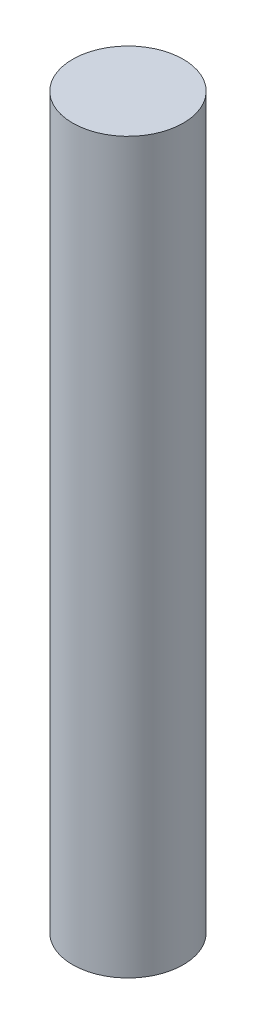
from build123d import *

# Parameters (mm, degrees)
SKETCH1_R           = 10.795
BOSS_EXTRUDE1_DEPTH = 142.24


with BuildPart() as part:
    # Sketch1 → Boss-Extrude1 (new body)
    with BuildSketch(Plane(origin=(0, 0, 0), x_dir=(1, 0, 0), z_dir=(0, 1, 0))):
        with Locations(Location((0, 0, 0), (0, 0, 270))):
            Circle(SKETCH1_R)
    extrude(amount=BOSS_EXTRUDE1_DEPTH)


solid = part.part
